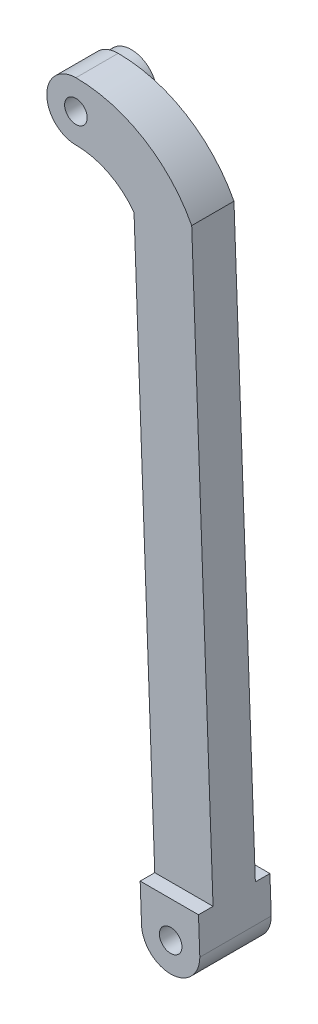
from build123d import *

# Parameters (mm, degrees)
BOSS_EXTRU_1_DEPTH      = 4.9
BOSS_EXTRU_1_DEPTH_BACK = 4.9
ESQUISSE1_R             = 1.55
CUT_EXTRUDE1_START      = -2
CUT_EXTRUDE1_DEPTH      = 2
BOSS_EXTRUDE1_START     = 1.8
SKETCH2_R               = 3.55
SKETCH2_R_2             = 1.55
BOSS_EXTRUDE1_DEPTH     = 1.8


with BuildPart() as part:
    # Esquisse1 → Boss.-Extru.1 (new, two sides: drawn at the far end of the back side and taken through both)
    with BuildSketch(Plane.XY.offset(-BOSS_EXTRU_1_DEPTH_BACK)):
        with BuildLine():
            Line((-7.025348052, 81.979968784), (-4, 0))
            ThreePointArc((-4, 0), (0, -4), (4, 0))
            Line((4, 0), (0.886406153, 84.37122672))
            ThreePointArc((0.886406153, 84.37122672), (-5.711685092, 91.40489844), (-15, 94))
            ThreePointArc((-15, 94), (-19, 90), (-15, 86))
            ThreePointArc((-15, 86), (-10.534696968, 84.938161277), (-7.025348052, 81.979968784))
        make_face()
        Circle(ESQUISSE1_R, mode=Mode.SUBTRACT)
        with Locations((-15, 90)):
            Circle(ESQUISSE1_R, mode=Mode.SUBTRACT)
    extrude(amount=BOSS_EXTRU_1_DEPTH + BOSS_EXTRU_1_DEPTH_BACK)

    # Sketch1 → Cut-Extrude1 (cut)
    with BuildSketch(Plane.XY.offset(4.9).offset(CUT_EXTRUDE1_START)):
        with BuildLine():
            Line((-7.025348052, 81.979968784), (-4.182805069, 4.953596614))
            Line((-4.182805069, 4.953596614), (3.817194931, 4.953596614))
            Line((3.817194931, 4.953596614), (0.886406153, 84.37122672))
            ThreePointArc((0.886406153, 84.37122672), (-5.711685092, 91.40489844), (-15, 94))
            ThreePointArc((-15, 94), (-19, 90), (-15, 86))
            ThreePointArc((-15, 86), (-10.534696968, 84.938161277), (-7.025348052, 81.979968784))
        make_face()
    cut_extrude1 = extrude(amount=CUT_EXTRUDE1_DEPTH, mode=Mode.SUBTRACT)

    # Mirror1: Cut-Extrude1 across plane
    add(cut_extrude1.mirror(Plane.XY), mode=Mode.SUBTRACT)

    # Sketch2 → Boss-Extrude1 (add)
    with BuildSketch(Plane(origin=(0, 0, -2.9), x_dir=(-1, 0, 0), z_dir=(0, 0, -1)).offset(BOSS_EXTRUDE1_START)):
        with Locations((15, 90)):
            Circle(SKETCH2_R)
        with Locations((15, 90)):
            Circle(SKETCH2_R_2, mode=Mode.SUBTRACT)
    extrude(amount=-BOSS_EXTRUDE1_DEPTH)


solid = part.part
